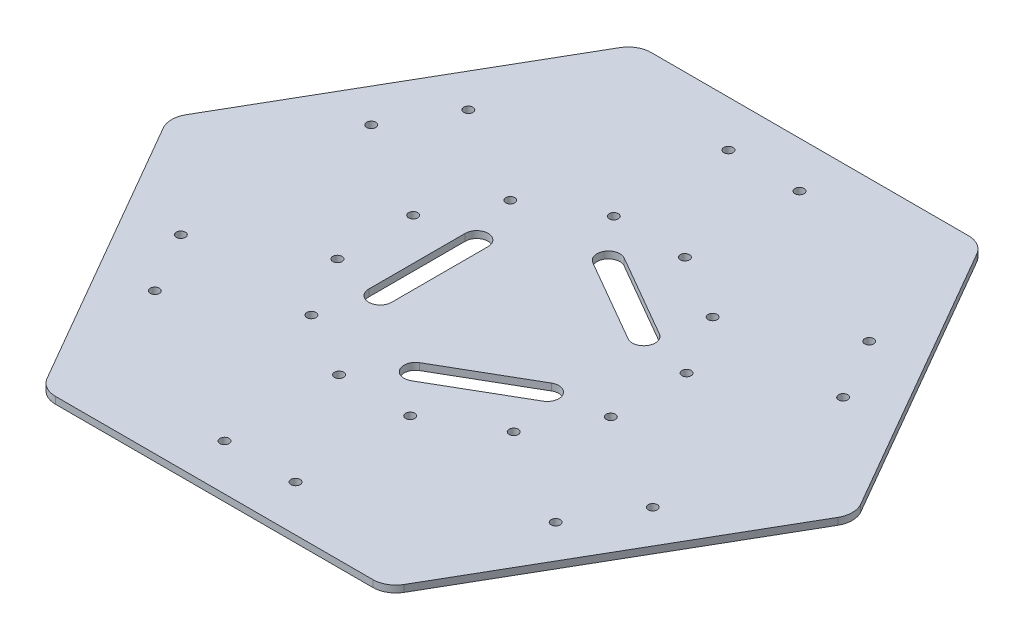
from build123d import *

# Parameters (mm, degrees)
ESQUISSE1_R             = 2
BOSS_EXTRU_1_DEPTH      = 3
CONG_2_R                = 10
CONG_3_R                = 10
ENL_V_MAT_EXTRU_1_DEPTH = 198.287332615


with BuildPart() as part:
    # Esquisse1 → Boss.-Extru.1 (new body)
    with BuildSketch(Plane(origin=(0, 0, 0), x_dir=(1, 0, 0), z_dir=(0, 1, 0))):
        Polygon((-150, 0), (-75, -129.903810568), (75, -129.903810568), (150, 0), (75, 129.903810568), (-75, 129.903810568), align=None)
        with Locations(Location((15.5, -109.903810568, 0), (0, 0, 270))):
            Circle(ESQUISSE1_R, mode=Mode.SUBTRACT)
        with Locations(Location((-15.5, -109.903810568, 0), (0, 0, 90))):
            Circle(ESQUISSE1_R, mode=Mode.SUBTRACT)
        with Locations(Location((15.5, -59.903810568, 0), (0, 0, 270))):
            Circle(ESQUISSE1_R, mode=Mode.SUBTRACT)
        with Locations(Location((-15.5, -59.903810568, 0), (0, 0, 90))):
            Circle(ESQUISSE1_R, mode=Mode.SUBTRACT)
        with Locations(Location((-87.429491924, -68.375299042, 0), (0, 0, 270))):
            Circle(ESQUISSE1_R, mode=Mode.SUBTRACT)
        with Locations(Location((-102.929491924, -41.528511525, 0), (0, 0, 90))):
            Circle(ESQUISSE1_R, mode=Mode.SUBTRACT)
        with Locations(Location((-59.628221735, -16.528511525, 0), (0, 0, 90))):
            Circle(ESQUISSE1_R, mode=Mode.SUBTRACT)
        with Locations(Location((-44.128221735, -43.375299042, 0), (0, 0, 270))):
            Circle(ESQUISSE1_R, mode=Mode.SUBTRACT)
        with Locations(Location((-102.929491924, 41.528511525, 0), (0, 0, 270))):
            Circle(ESQUISSE1_R, mode=Mode.SUBTRACT)
        with Locations(Location((-87.429491924, 68.375299042, 0), (0, 0, 90))):
            Circle(ESQUISSE1_R, mode=Mode.SUBTRACT)
        with Locations(Location((-44.128221735, 43.375299042, 0), (0, 0, 90))):
            Circle(ESQUISSE1_R, mode=Mode.SUBTRACT)
        with Locations(Location((-59.628221735, 16.528511525, 0), (0, 0, 270))):
            Circle(ESQUISSE1_R, mode=Mode.SUBTRACT)
        with Locations(Location((-15.5, 109.903810568, 0), (0, 0, 270))):
            Circle(ESQUISSE1_R, mode=Mode.SUBTRACT)
        with Locations(Location((15.5, 109.903810568, 0), (0, 0, 90))):
            Circle(ESQUISSE1_R, mode=Mode.SUBTRACT)
        with Locations(Location((15.5, 59.903810568, 0), (0, 0, 90))):
            Circle(ESQUISSE1_R, mode=Mode.SUBTRACT)
        with Locations(Location((-15.5, 59.903810568, 0), (0, 0, 270))):
            Circle(ESQUISSE1_R, mode=Mode.SUBTRACT)
        with Locations(Location((87.429491924, 68.375299042, 0), (0, 0, 270))):
            Circle(ESQUISSE1_R, mode=Mode.SUBTRACT)
        with Locations(Location((102.929491924, 41.528511525, 0), (0, 0, 90))):
            Circle(ESQUISSE1_R, mode=Mode.SUBTRACT)
        with Locations(Location((59.628221735, 16.528511525, 0), (0, 0, 90))):
            Circle(ESQUISSE1_R, mode=Mode.SUBTRACT)
        with Locations(Location((44.128221735, 43.375299042, 0), (0, 0, 270))):
            Circle(ESQUISSE1_R, mode=Mode.SUBTRACT)
        with Locations(Location((102.929491924, -41.528511525, 0), (0, 0, 270))):
            Circle(ESQUISSE1_R, mode=Mode.SUBTRACT)
        with Locations(Location((87.429491924, -68.375299042, 0), (0, 0, 90))):
            Circle(ESQUISSE1_R, mode=Mode.SUBTRACT)
        with Locations(Location((44.128221735, -43.375299042, 0), (0, 0, 90))):
            Circle(ESQUISSE1_R, mode=Mode.SUBTRACT)
        with Locations(Location((59.628221735, -16.528511525, 0), (0, 0, 270))):
            Circle(ESQUISSE1_R, mode=Mode.SUBTRACT)
    extrude(amount=BOSS_EXTRU_1_DEPTH)

    # Congé2
    cong_2_edges = [part.edges().sort_by_distance(p)[0] for p in [
        (-75, 1.5, -129.903810568),
    ]]
    fillet(cong_2_edges, radius=CONG_2_R)

    # Congé3
    cong_3_edges = [part.edges().sort_by_distance(p)[0] for p in [
        (75, 1.5, -129.903810568),
        (150, 1.5, 0),
        (75, 1.5, 129.903810568),
        (-75, 1.5, 129.903810568),
        (-150, 1.5, 0),
    ]]
    fillet(cong_3_edges, radius=CONG_3_R)

    # Esquisse3 → Enlèv. mat.-Extru.1 (cut, through all)
    with BuildSketch(Plane(origin=(0, 3, 0), x_dir=(1, 0, 0), z_dir=(0, 1, 0))):
        with BuildLine():
            Line((2.5, 46.406387956), (38.939110868, 25.368257487))
            ThreePointArc((38.939110868, 25.368257487), (40.769237886, 18.538130468), (33.939110868, 16.708003449))
            Line((33.939110868, 16.708003449), (-2.5, 37.746133918))
            ThreePointArc((-2.5, 37.746133918), (-4.330127019, 44.576260937), (2.5, 46.406387956))
        make_face()
        with BuildLine():
            Line((38.939110868, -25.368257487), (2.5, -46.406387956))
            ThreePointArc((2.5, -46.406387956), (-4.330127019, -44.576260937), (-2.5, -37.746133918))
            Line((-2.5, -37.746133918), (33.939110868, -16.708003449))
            ThreePointArc((33.939110868, -16.708003449), (40.769237886, -18.538130468), (38.939110868, -25.368257487))
        make_face()
        with BuildLine():
            Line((-41.439110868, -21.038130468), (-41.439110868, 21.038130468))
            ThreePointArc((-41.439110868, 21.038130468), (-36.439110868, 26.038130468), (-31.439110868, 21.038130468))
            Line((-31.439110868, 21.038130468), (-31.439110868, -21.038130468))
            ThreePointArc((-31.439110868, -21.038130468), (-36.439110868, -26.038130468), (-41.439110868, -21.038130468))
        make_face()
    extrude(amount=-ENL_V_MAT_EXTRU_1_DEPTH, mode=Mode.SUBTRACT)


solid = part.part
